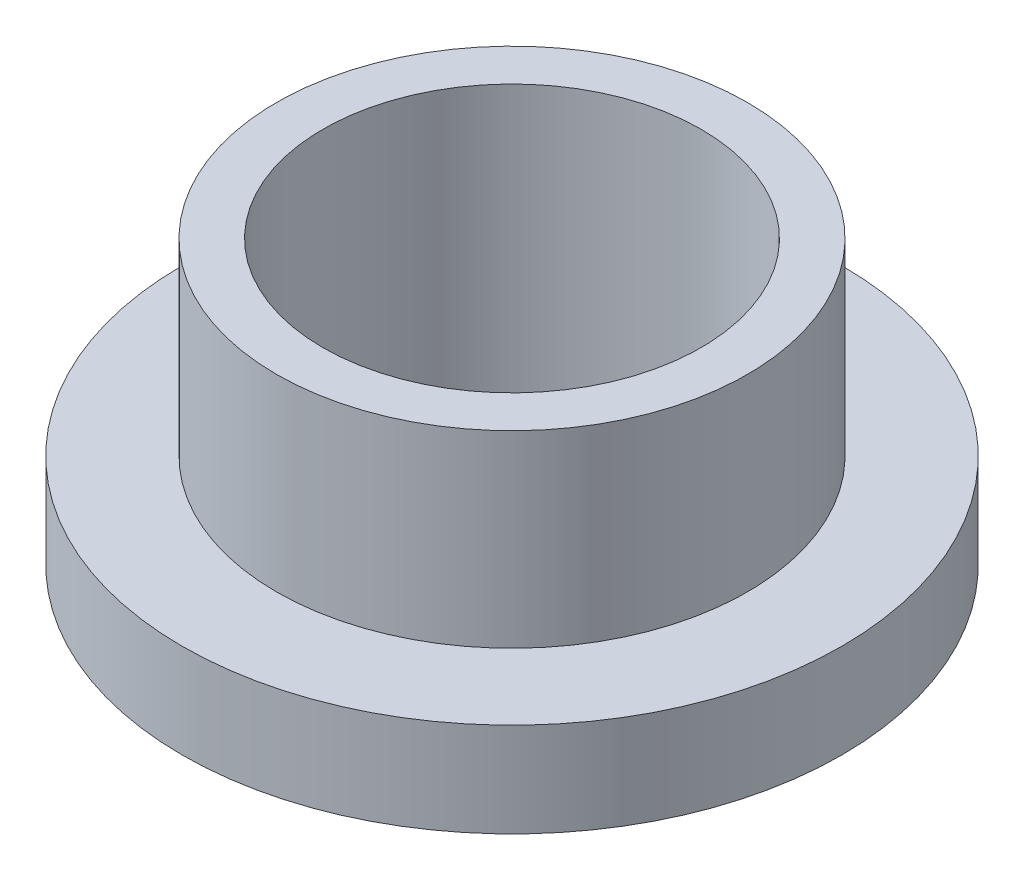
from build123d import *

# Parameters (mm, degrees)
SKETCH2_R           = 7.9375
SKETCH2_R_2         = 6.3754
BOSS_EXTRUDE1_DEPTH = 9.525
SKETCH3_R           = 11.1125
SKETCH3_R_2         = 7.9375
BOSS_EXTRUDE2_DEPTH = 3.175


with BuildPart() as part:
    # Sketch2 → Boss-Extrude1 (new body)
    with BuildSketch(Plane(origin=(0, 0, 0), x_dir=(1, 0, 0), z_dir=(0, 1, 0))):
        with Locations(Location((0, 0, 0), (0, 0, 90))):
            Circle(SKETCH2_R)
        with Locations(Location((0, 0, 0), (0, 0, 90))):
            Circle(SKETCH2_R_2, mode=Mode.SUBTRACT)
    extrude(amount=BOSS_EXTRUDE1_DEPTH)

    # Sketch3 → Boss-Extrude2 (add)
    with BuildSketch(Plane(origin=(0, 0, 0), x_dir=(1, 0, 0), z_dir=(0, 1, 0))):
        with Locations(Location((0, 0, 0), (0, 0, 270))):
            Circle(SKETCH3_R)
        with Locations(Location((0, 0, 0), (0, 0, 90))):
            Circle(SKETCH3_R_2, mode=Mode.SUBTRACT)
    extrude(amount=BOSS_EXTRUDE2_DEPTH)


solid = part.part
